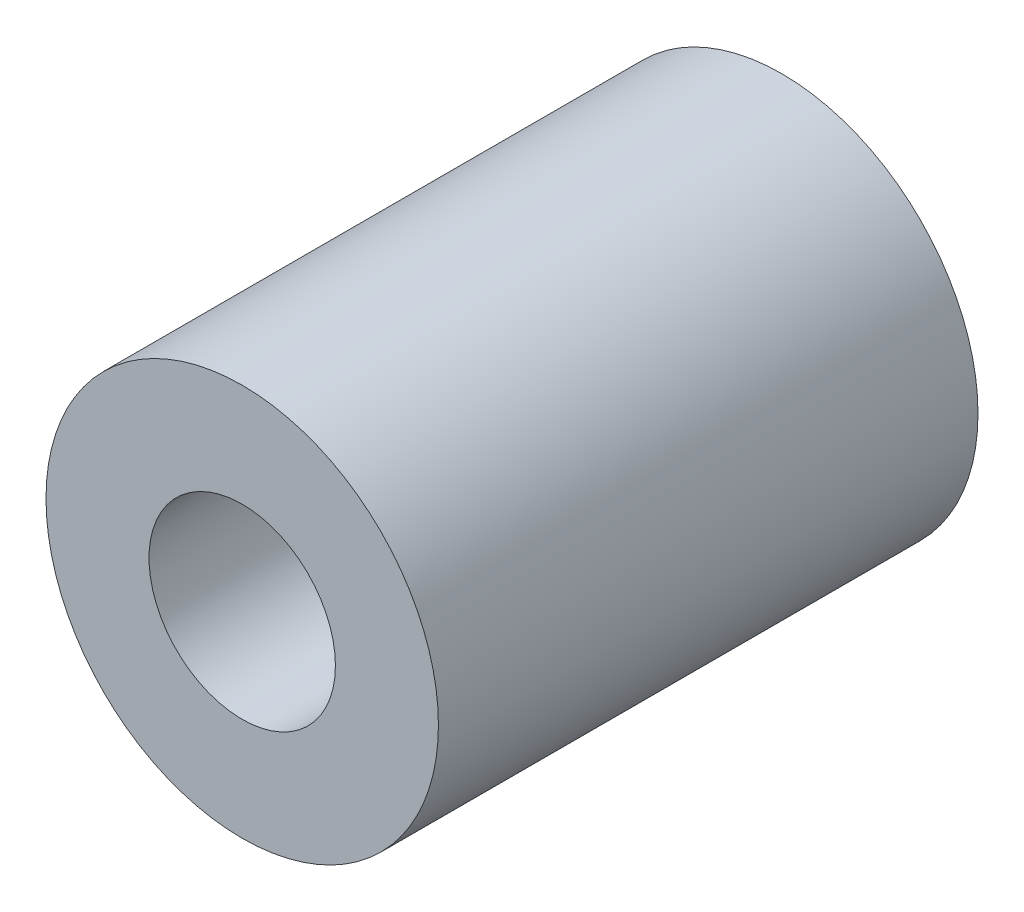
from build123d import *

# Parameters (mm, degrees)
SKETCH1_R           = 4
BOSS_EXTRUDE1_DEPTH = 7
SKETCH2_R           = 4
BOSS_EXTRUDE2_DEPTH = 4
SKETCH3_R           = 1.9
CUT_EXTRUDE1_DEPTH  = 4


with BuildPart() as part:
    # Sketch1 → Boss-Extrude1 (new body)
    with BuildSketch(Plane.XY):
        Circle(SKETCH1_R)
        Polygon((-1.6, 0), (-1.6, 2.6), (1.6, 2.6), (1.6, -2.6), (-1.6, -2.6), align=None, mode=Mode.SUBTRACT)
    extrude(amount=BOSS_EXTRUDE1_DEPTH)

    # Sketch2 → Boss-Extrude2 (add)
    with BuildSketch(Plane.XY.offset(7)):
        Circle(SKETCH2_R)
    extrude(amount=BOSS_EXTRUDE2_DEPTH)

    # Sketch3 → Cut-Extrude1 (cut)
    with BuildSketch(Plane.XY.offset(11)):
        Circle(SKETCH3_R)
    extrude(amount=-CUT_EXTRUDE1_DEPTH, mode=Mode.SUBTRACT)


solid = part.part
